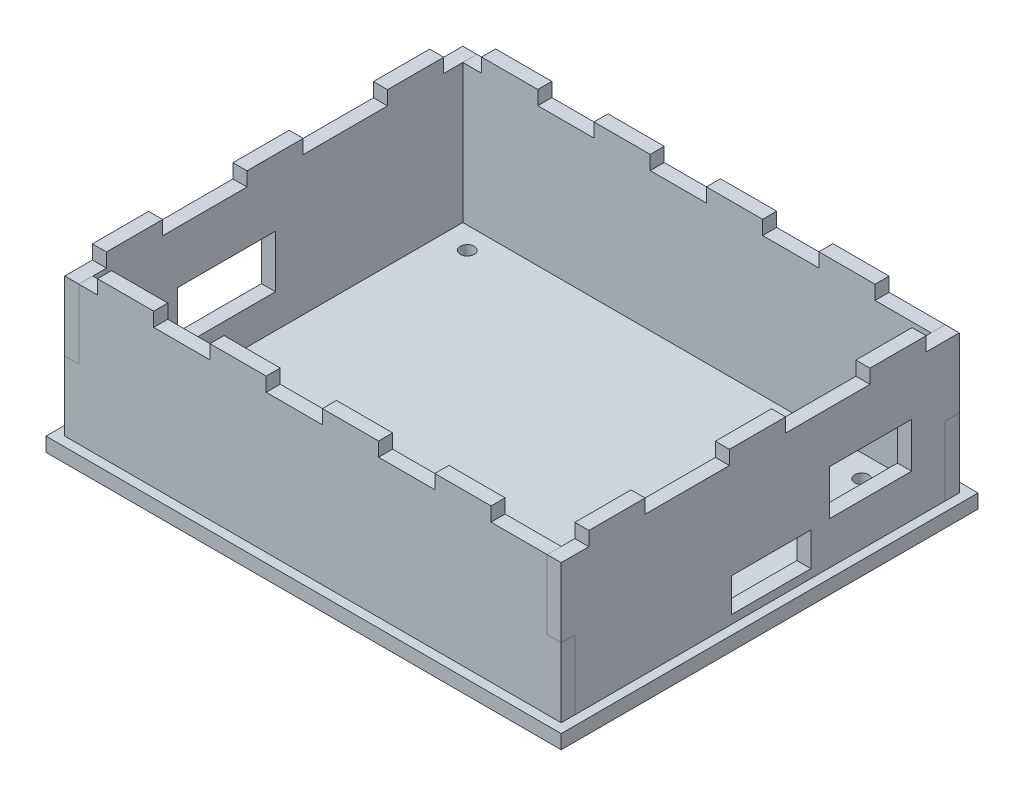
from build123d import *

# Parameters (mm, degrees)
SKETCH1_W              = 109.97478029
SKETCH1_H              = 88.97474981
SKETCH1_R              = 1.50000254
SKETCH1_W_2            = 3
SKETCH1_H_2            = 12
SKETCH1_W_3            = 12
SKETCH1_H_3            = 3
BOSS_EXTRUDE7_DEPTH    = 3
SKETCH1_9_W            = 12
SKETCH1_9_H            = 3
BOSS_EXTRUDE8_DEPTH    = 32.6
BOSS_EXTRUDE8_2_DEPTH  = 32.6
BOSS_EXTRUDE8_3_DEPTH  = 32.6
BOSS_EXTRUDE8_4_DEPTH  = 32.6
BOSS_EXTRUDE8_5_DEPTH  = 32.6
BOSS_EXTRUDE8_6_DEPTH  = 32.6
BOSS_EXTRUDE8_7_DEPTH  = 32.6
BOSS_EXTRUDE8_8_DEPTH  = 32.6
SKETCH11_W             = 99.97478029
SKETCH11_H             = 3
BOSS_EXTRUDE10_DEPTH   = 29.6
SKETCH13_W             = 3
SKETCH13_H             = 14.8
BOSS_EXTRUDE11_DEPTH   = 3
SKETCH14_W             = 3
SKETCH14_H             = 14.8
BOSS_EXTRUDE12_DEPTH   = 3
SKETCH19_W             = 12
SKETCH19_H             = 3
BOSS_EXTRUDE17_DEPTH   = 3
SKETCH1_10_W           = 3
SKETCH1_10_H           = 12
BOSS_EXTRUDE18_DEPTH   = 32.6
BOSS_EXTRUDE18_2_DEPTH = 32.6
BOSS_EXTRUDE18_3_DEPTH = 32.6
SKETCH23_W             = 3
SKETCH23_H             = 78.97474981
BOSS_EXTRUDE22_DEPTH   = 29.6
SKETCH24_W             = 3
SKETCH24_H             = 14.8
BOSS_EXTRUDE23_DEPTH   = 3
SKETCH25_W             = 3
SKETCH25_H             = 14.8
BOSS_EXTRUDE24_DEPTH   = 3
SKETCH26_W             = 3
SKETCH26_H             = 12
BOSS_EXTRUDE25_DEPTH   = 3
SKETCH29_W             = 16.899997478
SKETCH29_H             = 7.170342647
SKETCH29_W_2           = 17.499999673
SKETCH29_H_2           = 9.599999766
CUT_EXTRUDE4_DEPTH     = 10
SKETCH30_W             = 20.939331378
SKETCH30_H             = 11.199760673
CUT_EXTRUDE5_DEPTH     = 10


with BuildPart() as part:
    # Sketch1 → Boss-Extrude7 (new body)
    with BuildSketch(Plane(origin=(0, 0, 0), x_dir=(1, 0, 0), z_dir=(0, 1, 0))):
        with Locations((47.956716774, -41.662620739)):
            Rectangle(SKETCH1_W, SKETCH1_H)
        with Locations((87.908800848, -6.956551397)):
            Circle(SKETCH1_R, mode=Mode.SUBTRACT)
        with Locations((3.580632192, -6.829551143)):
            Circle(SKETCH1_R, mode=Mode.SUBTRACT)
        with Locations((3.8346327, -76.425690335)):
            Circle(SKETCH1_R, mode=Mode.SUBTRACT)
        with Locations((-3.530673371, -42.244450418)):
            Rectangle(SKETCH1_W_2, SKETCH1_H_2, mode=Mode.SUBTRACT)
        with Locations((-3.530673371, -12.244450418)):
            Rectangle(SKETCH1_W_2, SKETCH1_H_2, mode=Mode.SUBTRACT)
        with Locations((-3.530673371, -72.244450418)):
            Rectangle(SKETCH1_W_2, SKETCH1_H_2, mode=Mode.SUBTRACT)
        with Locations((99.444106919, -72.244450418)):
            Rectangle(SKETCH1_W_2, SKETCH1_H_2, mode=Mode.SUBTRACT)
        with Locations((99.444106919, -42.244450418)):
            Rectangle(SKETCH1_W_2, SKETCH1_H_2, mode=Mode.SUBTRACT)
        with Locations((99.444106919, -12.244450418)):
            Rectangle(SKETCH1_W_2, SKETCH1_H_2, mode=Mode.SUBTRACT)
        with Locations((7.969326629, -0.675245834)):
            Rectangle(SKETCH1_W_3, SKETCH1_H_3, mode=Mode.SUBTRACT)
        with Locations((31.969326629, -0.675245834)):
            Rectangle(SKETCH1_W_3, SKETCH1_H_3, mode=Mode.SUBTRACT)
        with Locations((55.969326629, -0.675245834)):
            Rectangle(SKETCH1_W_3, SKETCH1_H_3, mode=Mode.SUBTRACT)
        with Locations((79.969326629, -0.675245834)):
            Rectangle(SKETCH1_W_3, SKETCH1_H_3, mode=Mode.SUBTRACT)
        with Locations((79.969326629, -82.649995644)):
            Rectangle(SKETCH1_W_3, SKETCH1_H_3, mode=Mode.SUBTRACT)
        with Locations((55.969326629, -82.649995644)):
            Rectangle(SKETCH1_W_3, SKETCH1_H_3, mode=Mode.SUBTRACT)
        with Locations((31.969326629, -82.649995644)):
            Rectangle(SKETCH1_W_3, SKETCH1_H_3, mode=Mode.SUBTRACT)
        with Locations((7.969326629, -82.649995644)):
            Rectangle(SKETCH1_W_3, SKETCH1_H_3, mode=Mode.SUBTRACT)
    extrude(amount=BOSS_EXTRUDE7_DEPTH)


with BuildPart() as body_2:
    # Sketch1<9> → Boss-Extrude8 (new body)
    with BuildSketch(Plane(origin=(0, 0, 0), x_dir=(1, 0, 0), z_dir=(0, 1, 0))):
        with Locations((7.969326629, -0.675245834)):
            Rectangle(SKETCH1_9_W, SKETCH1_9_H)
    extrude(amount=BOSS_EXTRUDE8_DEPTH)



with BuildPart() as body_3:
    # Sketch1<9> → Boss-Extrude8 2 (new body)
    with BuildSketch(Plane(origin=(0, 0, 0), x_dir=(1, 0, 0), z_dir=(0, 1, 0))):
        with Locations((31.969326629, -0.675245834)):
            Rectangle(SKETCH1_9_W, SKETCH1_9_H)
    extrude(amount=BOSS_EXTRUDE8_2_DEPTH)


with BuildPart() as body_4:
    # Sketch1<9> → Boss-Extrude8 3 (new body)
    with BuildSketch(Plane(origin=(0, 0, 0), x_dir=(1, 0, 0), z_dir=(0, 1, 0))):
        with Locations((55.969326629, -0.675245834)):
            Rectangle(SKETCH1_9_W, SKETCH1_9_H)
    extrude(amount=BOSS_EXTRUDE8_3_DEPTH)


with BuildPart() as body_5:
    # Sketch1<9> → Boss-Extrude8 4 (new body)
    with BuildSketch(Plane(origin=(0, 0, 0), x_dir=(1, 0, 0), z_dir=(0, 1, 0))):
        with Locations((79.969326629, -0.675245834)):
            Rectangle(SKETCH1_9_W, SKETCH1_9_H)
    extrude(amount=BOSS_EXTRUDE8_4_DEPTH)


with BuildPart() as body_6:
    # Sketch1<9> → Boss-Extrude8 5 (new body)
    with BuildSketch(Plane(origin=(0, 0, 0), x_dir=(1, 0, 0), z_dir=(0, 1, 0))):
        with Locations((79.969326629, -82.649995644)):
            Rectangle(SKETCH1_9_W, SKETCH1_9_H)
    extrude(amount=BOSS_EXTRUDE8_5_DEPTH)


with BuildPart() as body_7:
    # Sketch1<9> → Boss-Extrude8 6 (new body)
    with BuildSketch(Plane(origin=(0, 0, 0), x_dir=(1, 0, 0), z_dir=(0, 1, 0))):
        with Locations((55.969326629, -82.649995644)):
            Rectangle(SKETCH1_9_W, SKETCH1_9_H)
    extrude(amount=BOSS_EXTRUDE8_6_DEPTH)


with BuildPart() as body_8:
    # Sketch1<9> → Boss-Extrude8 7 (new body)
    with BuildSketch(Plane(origin=(0, 0, 0), x_dir=(1, 0, 0), z_dir=(0, 1, 0))):
        with Locations((31.969326629, -82.649995644)):
            Rectangle(SKETCH1_9_W, SKETCH1_9_H)
    extrude(amount=BOSS_EXTRUDE8_7_DEPTH)


with BuildPart() as body_9:
    # Sketch1<9> → Boss-Extrude8 8 (new body)
    with BuildSketch(Plane(origin=(0, 0, 0), x_dir=(1, 0, 0), z_dir=(0, 1, 0))):
        with Locations((7.969326629, -82.649995644)):
            Rectangle(SKETCH1_9_W, SKETCH1_9_H)
    extrude(amount=BOSS_EXTRUDE8_8_DEPTH)


with BuildPart() as body_2_1:
    add(body_2.part)

    add(body_3.part)  # Boss-Extrude10 merges body 3

    add(body_4.part)  # Boss-Extrude10 merges body 4

    add(body_5.part)  # Boss-Extrude10 merges body 5
    # Sketch11 → Boss-Extrude10 (add)
    with BuildSketch(Plane(origin=(0, 32.6, 0), x_dir=(1, 0, 0), z_dir=(0, 1, 0))):
        with Locations((47.956716774, -0.675245834)):
            Rectangle(SKETCH11_W, SKETCH11_H)
    extrude(amount=-BOSS_EXTRUDE10_DEPTH)

    # Sketch13 → Boss-Extrude11 (add)
    with BuildSketch(Plane(origin=(97.944106919, 0, 0), x_dir=(0, 0, -1), z_dir=(1, 0, 0))):
        with Locations((-0.675245834, 10.4)):
            Rectangle(SKETCH13_W, SKETCH13_H)
    extrude(amount=BOSS_EXTRUDE11_DEPTH)

    # Sketch14 → Boss-Extrude12 (add)
    with BuildSketch(Plane.ZY.offset(2.030673371)):
        with Locations((0.675245834, 10.4)):
            Rectangle(SKETCH14_W, SKETCH14_H)
    extrude(amount=BOSS_EXTRUDE12_DEPTH)

    # Sketch19 → Boss-Extrude17 (add)
    with BuildSketch(Plane(origin=(0, 32.6, 0), x_dir=(1, 0, 0), z_dir=(0, 1, 0))):
        with Locations((79.969326629, -0.675245834)):
            Rectangle(SKETCH19_W, SKETCH19_H)
        with Locations((55.969326629, -0.675245834)):
            Rectangle(SKETCH19_W, SKETCH19_H)
        with Locations((31.969326629, -0.675245834)):
            Rectangle(SKETCH19_W, SKETCH19_H)
        with Locations((7.969326629, -0.675245834)):
            Rectangle(SKETCH19_W, SKETCH19_H)
    extrude(amount=BOSS_EXTRUDE17_DEPTH)


with BuildPart() as body_3_2:
    # Sketch1<10> → Boss-Extrude18 (new body)
    with BuildSketch(Plane(origin=(0, 0, 0), x_dir=(1, 0, 0), z_dir=(0, 1, 0))):
        with Locations((99.444106919, -72.244450418)):
            Rectangle(SKETCH1_10_W, SKETCH1_10_H)
    extrude(amount=BOSS_EXTRUDE18_DEPTH)



with BuildPart() as body_4_2:
    # Sketch1<10> → Boss-Extrude18 2 (new body)
    with BuildSketch(Plane(origin=(0, 0, 0), x_dir=(1, 0, 0), z_dir=(0, 1, 0))):
        with Locations((99.444106919, -42.244450418)):
            Rectangle(SKETCH1_10_W, SKETCH1_10_H)
    extrude(amount=BOSS_EXTRUDE18_2_DEPTH)


with BuildPart() as body_5_2:
    # Sketch1<10> → Boss-Extrude18 3 (new body)
    with BuildSketch(Plane(origin=(0, 0, 0), x_dir=(1, 0, 0), z_dir=(0, 1, 0))):
        with Locations((99.444106919, -12.244450418)):
            Rectangle(SKETCH1_10_W, SKETCH1_10_H)
    extrude(amount=BOSS_EXTRUDE18_3_DEPTH)


with BuildPart() as body_3_2_1:
    add(body_3_2.part)

    add(body_4_2.part)  # Boss-Extrude22 merges body 4 2

    add(body_5_2.part)  # Boss-Extrude22 merges body 5 2
    # Sketch23 → Boss-Extrude22 (add)
    with BuildSketch(Plane(origin=(0, 3, 0), x_dir=(1, 0, 0), z_dir=(0, 1, 0))):
        with Locations((99.444106919, -41.662620739)):
            Rectangle(SKETCH23_W, SKETCH23_H)
    extrude(amount=BOSS_EXTRUDE22_DEPTH)

    # Sketch24 → Boss-Extrude23 (add)
    with BuildSketch(Plane(origin=(0, 0, 2.175245834), x_dir=(-1, 0, 0), z_dir=(0, 0, -1))):
        with Locations((-99.444106919, 25.2)):
            Rectangle(SKETCH24_W, SKETCH24_H)
    extrude(amount=BOSS_EXTRUDE23_DEPTH)

    # Sketch25 → Boss-Extrude24 (add)
    with BuildSketch(Plane.XY.offset(81.149995644)):
        with Locations((99.444106919, 25.2)):
            Rectangle(SKETCH25_W, SKETCH25_H)
    extrude(amount=BOSS_EXTRUDE24_DEPTH)

    # Sketch26 → Boss-Extrude25 (add)
    with BuildSketch(Plane(origin=(0, 32.6, 0), x_dir=(1, 0, 0), z_dir=(0, 1, 0))):
        with Locations((99.444106919, -72.244450418)):
            Rectangle(SKETCH26_W, SKETCH26_H)
        with Locations((99.444106919, -42.244450418)):
            Rectangle(SKETCH26_W, SKETCH26_H)
        with Locations((99.444106919, -12.244450418)):
            Rectangle(SKETCH26_W, SKETCH26_H)
    extrude(amount=BOSS_EXTRUDE25_DEPTH)


with BuildPart() as body_4_3:
    # Mirror4: mirrored copy
    add(body_3_2_1.part.mirror(Plane.ZY.offset(-47.956716774)))

    # Sketch30 → Cut-Extrude5 (cut)
    with BuildSketch(Plane.ZY.offset(5.030673371)):
        with Locations((52.635601435, 15.799929792)):
            Rectangle(SKETCH30_W, SKETCH30_H)
    extrude(amount=-CUT_EXTRUDE5_DEPTH, mode=Mode.SUBTRACT)


with BuildPart() as body_5_3:
    # Mirror5: mirrored copy
    add(body_2_1.part.mirror(Plane.XY.offset(41.662620739)))


with BuildPart() as body_3_2_2:
    add(body_3_2_1.part)

    # Sketch29 → Cut-Extrude4 (cut)
    with BuildSketch(Plane(origin=(100.944106919, 0, 0), x_dir=(0, 0, -1), z_dir=(1, 0, 0))):
        with Locations((-39.296607277, 8.414828677)):
            Rectangle(SKETCH29_W, SKETCH29_H)
        with Locations((-18.089421603, 16.900050683)):
            Rectangle(SKETCH29_W_2, SKETCH29_H_2)
    extrude(amount=-CUT_EXTRUDE4_DEPTH, mode=Mode.SUBTRACT)


solid = Compound([part.part, body_2_1.part, body_4_3.part, body_5_3.part, body_3_2_2.part])
